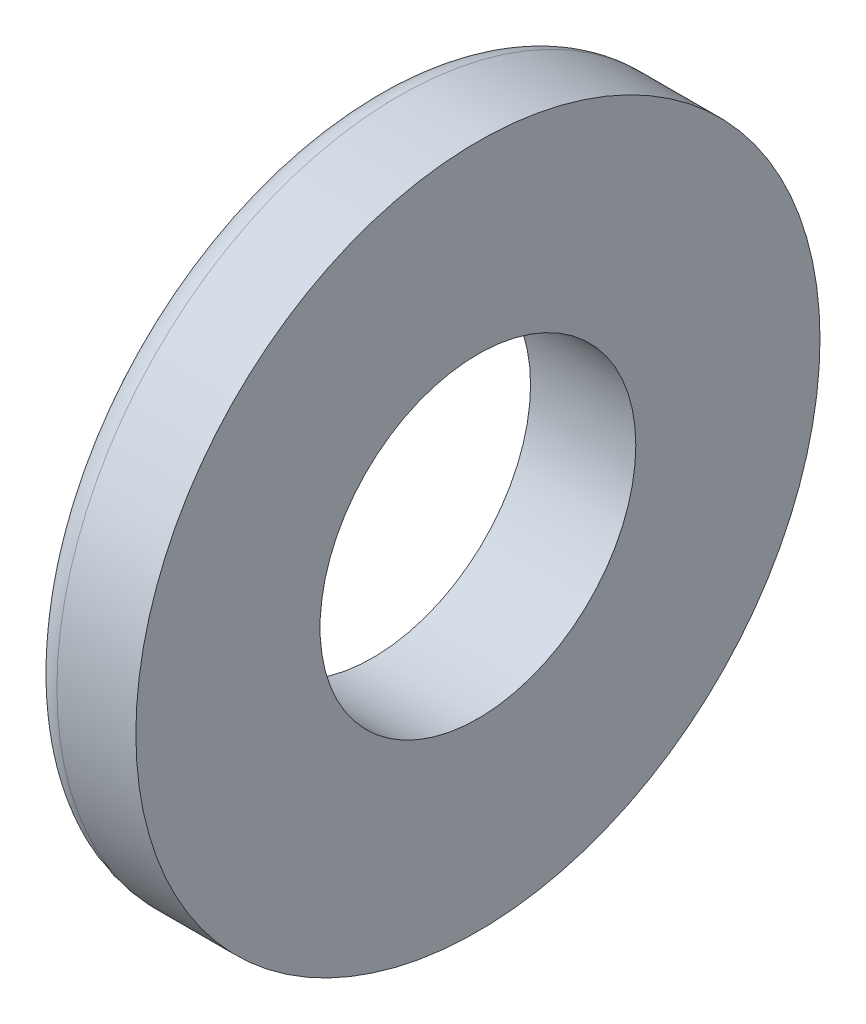
from build123d import *

# Parameters (mm, degrees)
SKETCH2_R           = 6.5
SKETCH2_R_2         = 3
BOSS_EXTRUDE1_DEPTH = 2
FILLET1_R           = 0.5


with BuildPart() as part:
    # Sketch2 → Boss-Extrude1 (new body)
    with BuildSketch(Plane(origin=(0, 0, 0), x_dir=(0, 0, -1), z_dir=(1, 0, 0))):
        Circle(SKETCH2_R)
        Circle(SKETCH2_R_2, mode=Mode.SUBTRACT)
    extrude(amount=BOSS_EXTRUDE1_DEPTH)

    # Fillet1
    fillet1_edges = [part.edges().sort_by_distance(p)[0] for p in [
        (0, 0, 6.5),
    ]]
    fillet(fillet1_edges, radius=FILLET1_R)


solid = part.part
